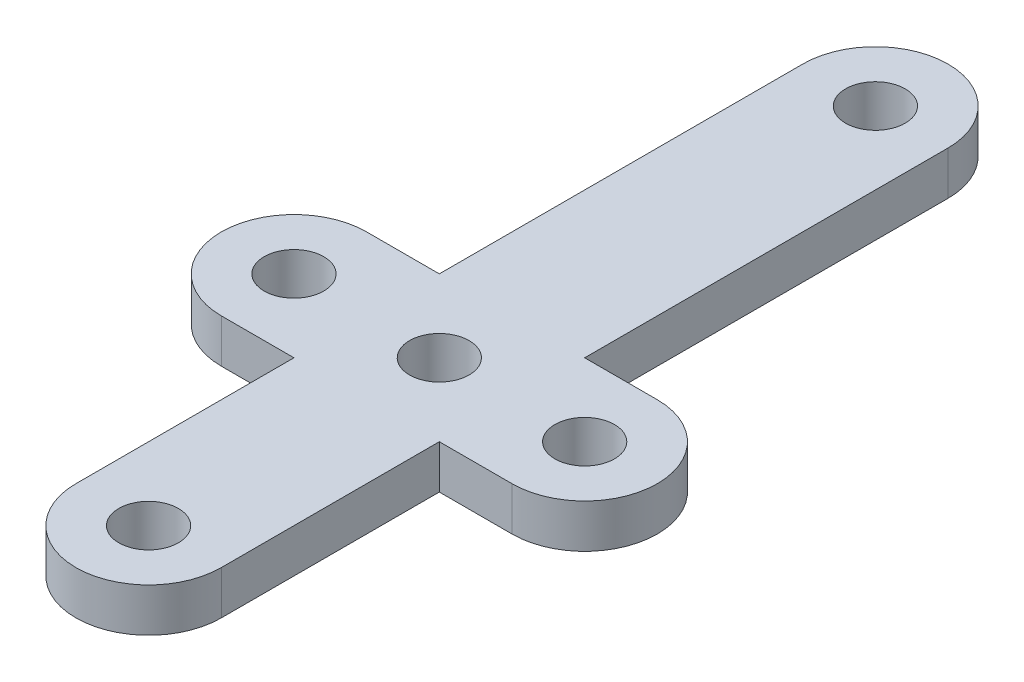
from build123d import *

# Parameters (mm, degrees)
SKETCH1_R           = 2.05
BOSS_EXTRUDE1_DEPTH = 1.5


with BuildPart() as part:
    # Sketch1 → Boss-Extrude1 (new, symmetric)
    with BuildSketch(Plane(origin=(0, 0, 0), x_dir=(1, 0, 0), z_dir=(0, 1, 0))):
        with BuildLine():
            Line((-10, 0), (-5, 0))
            Line((-5, 0), (-5, 25))
            ThreePointArc((-5, 25), (0, 30), (5, 25))
            Line((5, 25), (5, 0))
            Line((5, 0), (10, 0))
            ThreePointArc((10, 0), (15, -5), (10, -10))
            Line((10, -10), (5, -10))
            Line((5, -10), (5, -25))
            ThreePointArc((5, -25), (0, -30), (-5, -25))
            Line((-5, -25), (-5, -10))
            Line((-5, -10), (-10, -10))
            ThreePointArc((-10, -10), (-15, -5), (-10, 0))
        make_face()
        with Locations(Location((10, -5, 0), (0, 0, 270))):
            Circle(SKETCH1_R, mode=Mode.SUBTRACT)
        with Locations(Location((-10, -5, 0), (0, 0, 90))):
            Circle(SKETCH1_R, mode=Mode.SUBTRACT)
        with Locations(Location((0, -5, 0), (0, 0, 270))):
            Circle(SKETCH1_R, mode=Mode.SUBTRACT)
        with Locations(Location((0, 25, 0), (0, 0, 270))):
            Circle(SKETCH1_R, mode=Mode.SUBTRACT)
        with Locations(Location((0, -25, 0), (0, 0, 90))):
            Circle(SKETCH1_R, mode=Mode.SUBTRACT)
    extrude(amount=BOSS_EXTRUDE1_DEPTH, both=True)


solid = part.part
